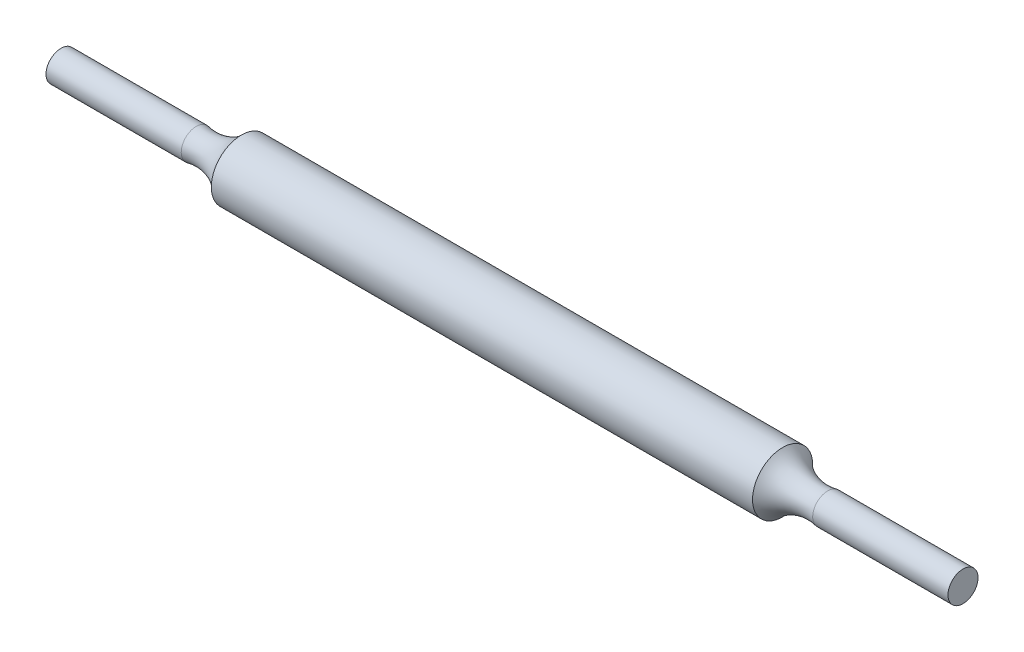
from build123d import *


with BuildPart() as part:
    # Sketch1 → Revolve1 (revolve)
    with BuildSketch(Plane(origin=(0, 0, 0), x_dir=(1, 0, 0), z_dir=(0, 1, 0)), mode=Mode.PRIVATE) as revolve1_sk:
        with BuildLine():
            Line((-29.997607303, 0), (30.002392697, 0))
            Line((30.002392697, 0), (30.002392697, 1))
            Line((30.002392697, 1), (21.002392697, 1))
            ThreePointArc((21.002392697, 1), (19.365438223, 1.089136578), (18.002392697, 2))
            Line((18.002392697, 2), (-18.002392697, 2))
            ThreePointArc((-18.002392697, 2), (-19.365438223, 1.089136578), (-21.002392697, 1))
            Line((-21.002392697, 1), (-29.997607303, 1))
            Line((-29.997607303, 1), (-29.997607303, 0))
        make_face()
    revolve(revolve1_sk.sketch.rotate(Axis((-29.997607303, 0, 0), (1, 0, 0)), 180), axis=Axis((-29.997607303, 0, 0), (1, 0, 0)))


solid = part.part
